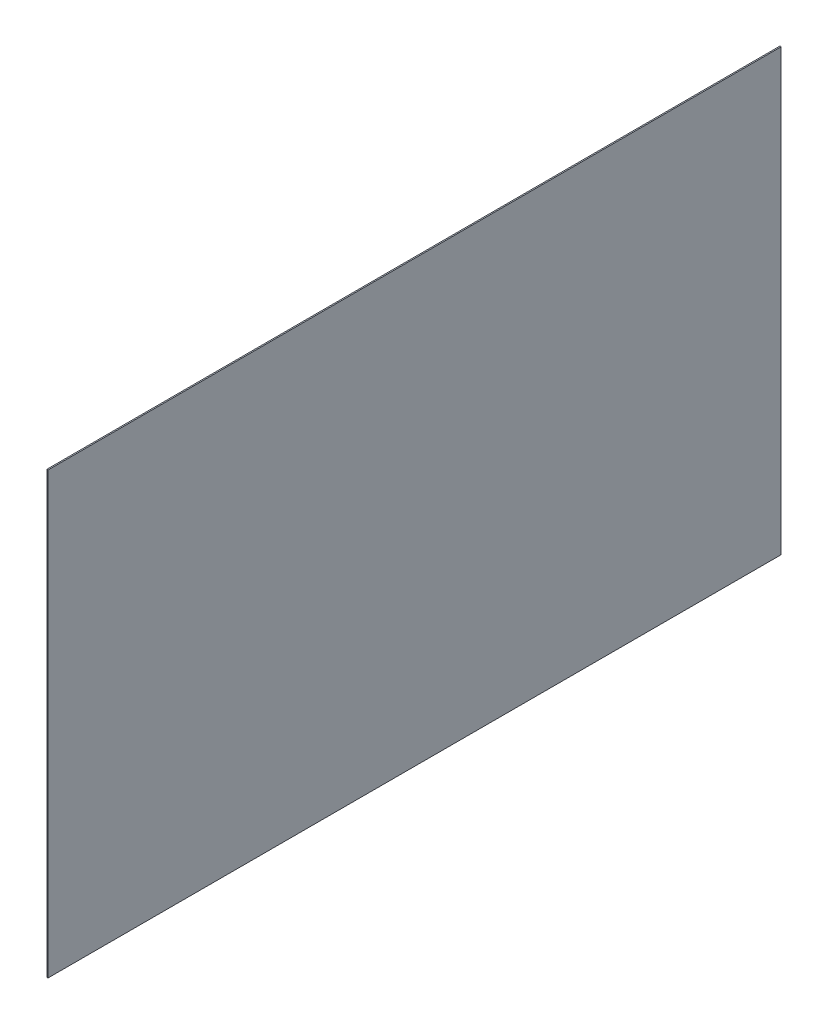
from build123d import *

# Parameters (mm, degrees)
SKETCH1_W           = 1524
SKETCH1_H           = 914.4
BOSS_EXTRUDE1_DEPTH = 2.54


with BuildPart() as part:
    # Sketch1 → Boss-Extrude1 (new body)
    with BuildSketch(Plane(origin=(0, 0, 0), x_dir=(0, 0, -1), z_dir=(1, 0, 0))):
        Rectangle(SKETCH1_W, SKETCH1_H)
    extrude(amount=BOSS_EXTRUDE1_DEPTH)


solid = part.part
